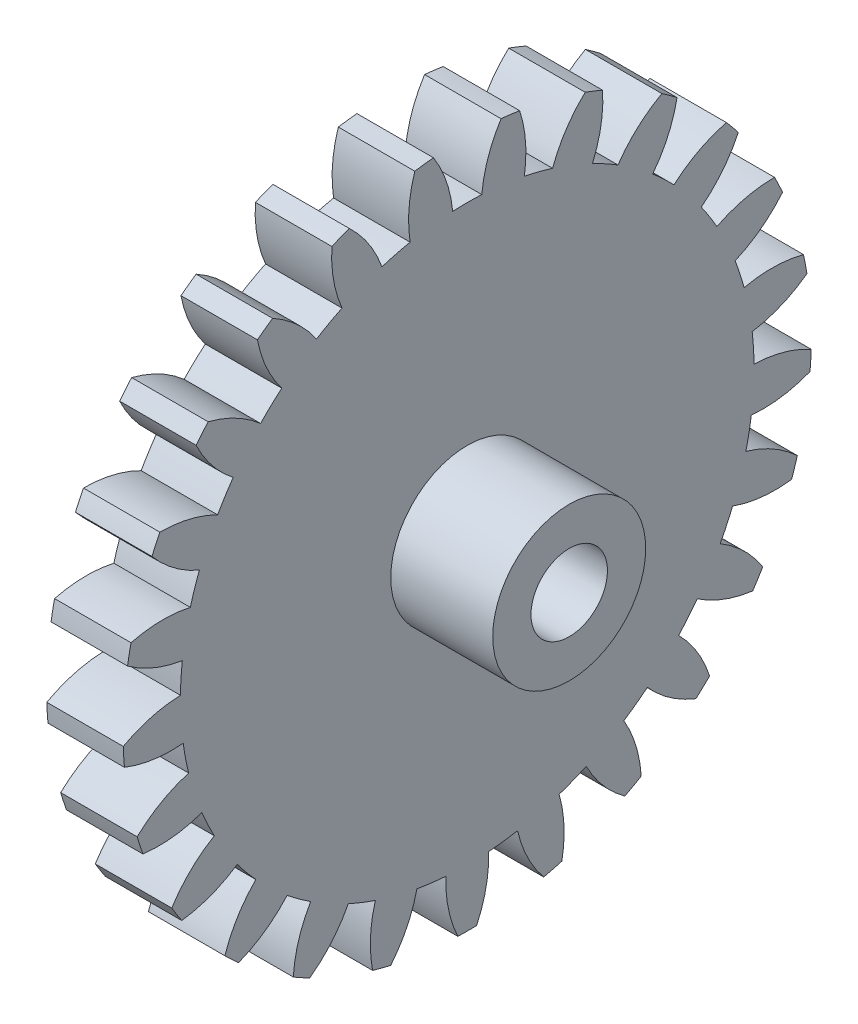
from build123d import *

# Parameters (mm, degrees)
BASPROSKE_W         = 3
BASPROSKE_H         = 13.5
TOOTHCUT_DEPTH      = 20.32614809
TEETHCUTS_COUNT     = 25
HUBNEABOTSKE_R      = 3
HUBNEARBOTH_DEPTH   = 1.0000254
HUBFAR_START        = 1.0000254
HUBFARSKE_R         = 3
HUBFAR_DEPTH        = 1.0000254
BORSKE_R            = 1.5
BORE_DEPTH          = 5.0000508
BOSS_EXTRUDE1_START = 3
SKETCH1_R           = 3
SKETCH1_R_2         = 1.5
BOSS_EXTRUDE1_DEPTH = 3


with BuildPart() as part:
    # BasProSke → Base-Revolve (revolve)
    with BuildSketch(Plane(origin=(0, 0, 0), x_dir=(1, 0, 0), z_dir=(0, 1, 0)), mode=Mode.PRIVATE) as base_revolve_sk:
        with Locations((1.5, 6.75)):
            Rectangle(BASPROSKE_W, BASPROSKE_H)
    revolve(base_revolve_sk.sketch.rotate(Axis((-10, 0, 0), (1, 0, 0)), 180), axis=Axis((-10, 0, 0), (1, 0, 0)))

    # TooCutSke → ToothCut (cut, through all)
    with BuildSketch(Plane(origin=(0, 0, 0), x_dir=(0, 0, -1), z_dir=(1, 0, 0))):
        with BuildLine():
            ThreePointArc((0.570809389, 11.23450834), (0, 11.249), (-0.570809389, 11.23450834))
            ThreePointArc((-0.570809389, 11.23450834), (-0.823468719, 12.39261054), (-1.341642157, 13.4586939))
            ThreePointArc((-1.341642157, 13.4586939), (0, 13.5254), (1.341642157, 13.4586939))
            ThreePointArc((1.341642157, 13.4586939), (0.823468719, 12.39261054), (0.570809389, 11.23450834))
        make_face()
    toothcut = extrude(amount=TOOTHCUT_DEPTH, mode=Mode.SUBTRACT)

    # TeethCuts: ToothCut ×25 about axis
    teethcuts_axis = Axis((0, 0, 0), (1, 0, 0))
    for i in range(1, TEETHCUTS_COUNT):
        add(toothcut.rotate(teethcuts_axis, i * 360 / TEETHCUTS_COUNT), mode=Mode.SUBTRACT)

    # HubNeaBotSke → HubNearBoth (add)
    with BuildSketch(Plane.ZY):
        with Locations(Location((0, 0, 0), (0, 0, 180))):
            Circle(HUBNEABOTSKE_R)
    extrude(amount=HUBNEARBOTH_DEPTH)

    # HubFarSke → HubFar (add)
    with BuildSketch(Plane(origin=(3, 0, 0), x_dir=(0, 0, -1), z_dir=(1, 0, 0)).offset(HUBFAR_START)):
        Circle(HUBFARSKE_R)
    extrude(amount=-HUBFAR_DEPTH)

    # BorSke → Bore (cut, symmetric)
    with BuildSketch(Plane(origin=(0, 0, 0), x_dir=(0, 0, -1), z_dir=(1, 0, 0))):
        with Locations(Location((0, 0, 0), (0, 0, 180))):
            Circle(BORSKE_R)
    extrude(amount=BORE_DEPTH, both=True, mode=Mode.SUBTRACT)

    # Sketch1 → Boss-Extrude1 (add)
    with BuildSketch(Plane(origin=(4.0000254, 0, 0), x_dir=(0, 0, -1), z_dir=(1, 0, 0)).offset(BOSS_EXTRUDE1_START)):
        Circle(SKETCH1_R)
        with Locations(Location((0, 0, 0), (0, 0, 180))):
            Circle(SKETCH1_R_2, mode=Mode.SUBTRACT)
    extrude(amount=-BOSS_EXTRUDE1_DEPTH)


solid = part.part
